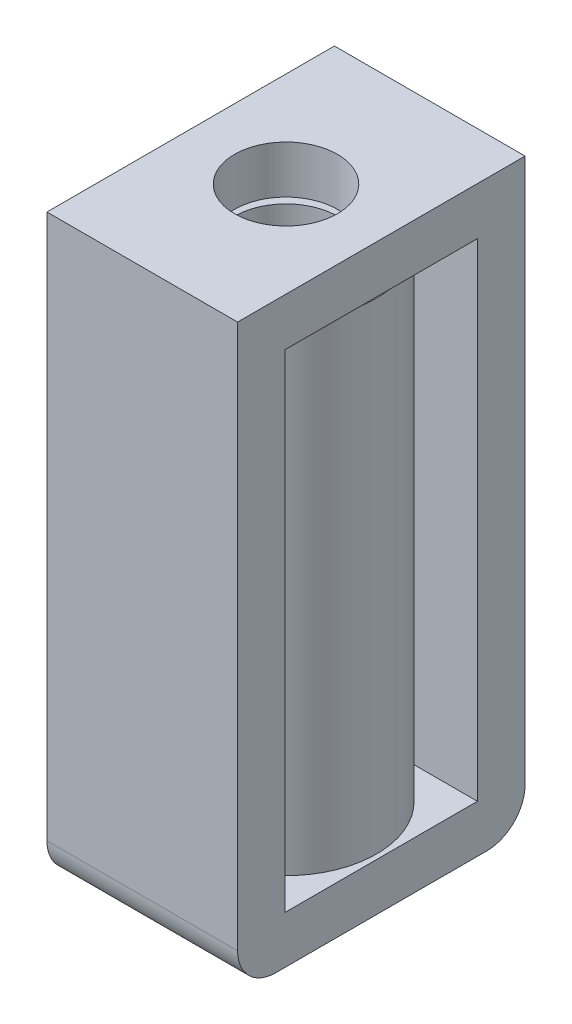
from build123d import *

# Parameters (mm, degrees)
SKETCH1_W           = 10
SKETCH1_H           = 15.08
BOSS_EXTRUDE1_DEPTH = 30.56
SKETCH2_W           = 10.08
SKETCH2_H           = 25.56
CUT_EXTRUDE1_DEPTH  = 20
SKETCH5_R           = 4.75
BOSS_EXTRUDE2_DEPTH = 25.25
SKETCH3_R           = 2.7
CUT_EXTRUDE2_DEPTH  = 20
FILLET1_R           = 2
CUT_EXTRUDE3_REACH  = 36.443
SKETCH4_R           = 0.8


with BuildPart() as part:
    # Sketch1 → Boss-Extrude1 (new body)
    with BuildSketch(Plane(origin=(0, 0, 0), x_dir=(1, 0, 0), z_dir=(0, 1, 0))):
        Rectangle(SKETCH1_W, SKETCH1_H)
    extrude(amount=BOSS_EXTRUDE1_DEPTH)

    # Sketch2 → Cut-Extrude1 (cut)
    with BuildSketch(Plane(origin=(5, 0, 0), x_dir=(0, 0, -1), z_dir=(1, 0, 0))):
        with Locations((0, 15.28)):
            Rectangle(SKETCH2_W, SKETCH2_H)
    extrude(amount=-CUT_EXTRUDE1_DEPTH, mode=Mode.SUBTRACT)

    # Sketch5 → Boss-Extrude2 (add)
    with BuildSketch(Plane(origin=(0, 2.5, 0), x_dir=(1, 0, 0), z_dir=(0, 1, 0))):
        with Locations(Location((0, 0, 0), (0, 0, 90))):
            Circle(SKETCH5_R)
    extrude(amount=BOSS_EXTRUDE2_DEPTH)

    # Sketch3 → Cut-Extrude2 (cut)
    with BuildSketch(Plane(origin=(0, 30.56, 0), x_dir=(1, 0, 0), z_dir=(0, 1, 0))):
        with Locations(Location((0, 0, 0), (0, 0, 270))):
            Circle(SKETCH3_R)
    extrude(amount=-CUT_EXTRUDE2_DEPTH, mode=Mode.SUBTRACT)

    # Fillet1
    fillet1_edges = [part.edges().sort_by_distance(p)[0] for p in [
        (0, 0, 7.54),
        (0, 0, -7.54),
    ]]
    fillet(fillet1_edges, radius=FILLET1_R)

    # Sketch4 → Cut-Extrude3 (cut, up to next)
    with BuildSketch(Plane(origin=(0, 0, -7.54), x_dir=(-1, 0, 0), z_dir=(0, 0, -1)), mode=Mode.PRIVATE) as cut_extrude3_sk1:
        with Locations((0, 22.26)):
            Circle(SKETCH4_R)
    cut_extrude3_tool1 = extrude(cut_extrude3_sk1.sketch, amount=-CUT_EXTRUDE3_REACH, mode=Mode.PRIVATE) & part.part
    # Sketch4 → Cut-Extrude3 (cut, up to next)
    with BuildSketch(Plane(origin=(0, 0, -7.54), x_dir=(-1, 0, 0), z_dir=(0, 0, -1)), mode=Mode.PRIVATE) as cut_extrude3_sk2:
        with Locations((0, 5.2)):
            Circle(SKETCH4_R)
    cut_extrude3_tool2 = extrude(cut_extrude3_sk2.sketch, amount=-CUT_EXTRUDE3_REACH, mode=Mode.PRIVATE) & part.part
    add(cut_extrude3_tool1.solids().sort_by_distance((0, 22.26, -7.54))[0], mode=Mode.SUBTRACT)
    add(cut_extrude3_tool2.solids().sort_by_distance((0, 5.2, -7.54))[0], mode=Mode.SUBTRACT)


solid = part.part
